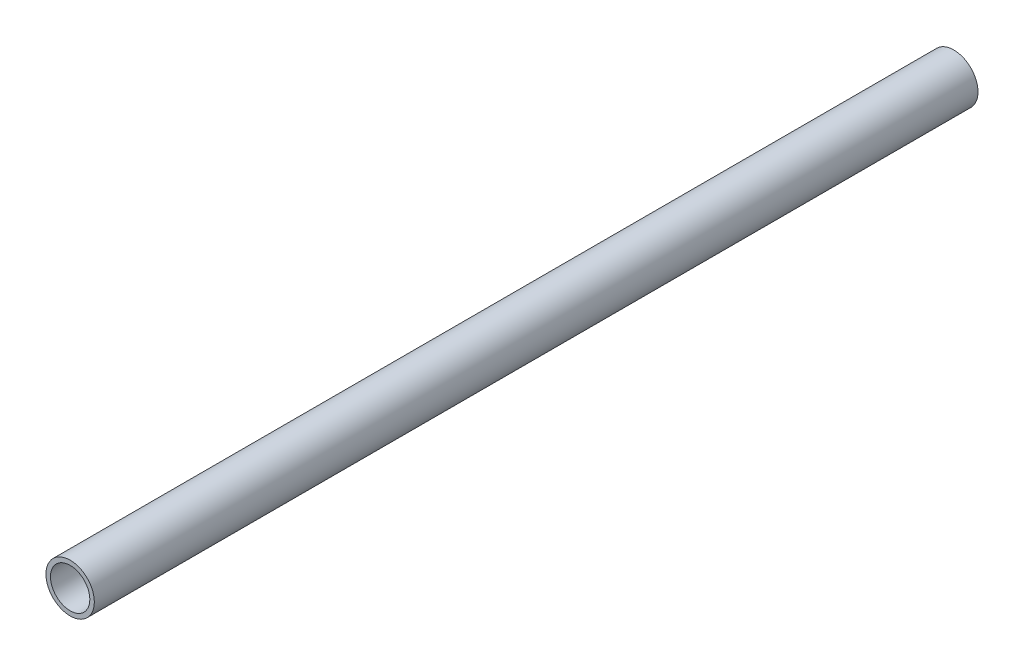
from build123d import *

# Parameters (mm, degrees)
SKETCH1_R           = 4.7625
SKETCH1_R_2         = 3.8735
BOSS_EXTRUDE1_DEPTH = 174


with BuildPart() as part:
    # Sketch1 → Boss-Extrude1 (new body)
    with BuildSketch(Plane.XY):
        Circle(SKETCH1_R)
        Circle(SKETCH1_R_2, mode=Mode.SUBTRACT)
    extrude(amount=BOSS_EXTRUDE1_DEPTH)


solid = part.part
